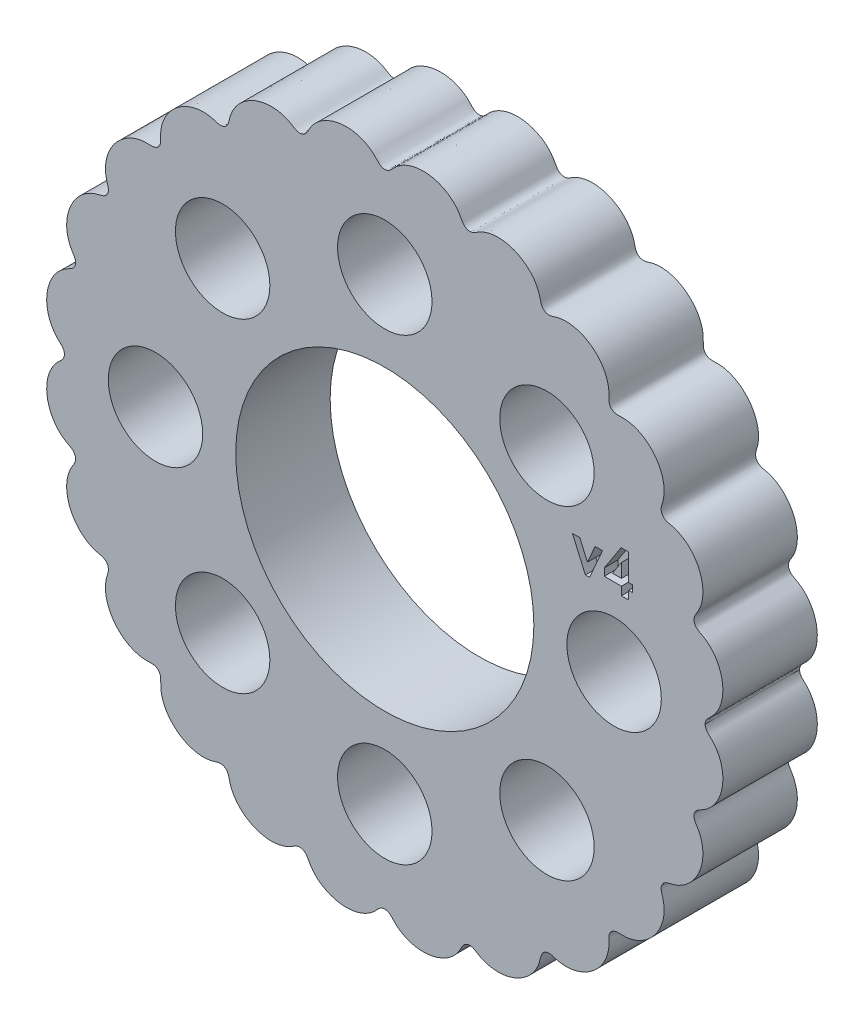
from build123d import *

# Parameters (mm, degrees)
BOSS_EXTRU_1_DEPTH      = 7
ESQUISSE2_R             = 11.05
ESQUISSE2_R_2           = 3.5
ENL_V_MAT_EXTRU_1_DEPTH = 37.128809587
VERSION_TEXT_DEPTH      = 1


with BuildPart() as part:
    # Esquisse1 → Boss.-Extru.1 (new body)
    with BuildSketch(Plane.XY):
        with BuildLine():
            add(Edge.make_bspline(
                [(23.75, 0), (23.75, 0.113685375), (23.821909441, 0.345296585), (24.077868999, 0.583486704), (24.326908063, 0.82199278), (24.613097625, 1.185219288), (24.880013662, 1.699987997), (25.052292539, 2.373710951), (25.0798311, 3.067999967), (24.965816076, 3.753404688), (24.714033606, 4.401107865), (24.329922533, 4.981029619), (23.904223084, 5.375759303), (23.512246653, 5.619286985), (23.197297598, 5.76581327), (22.949715111, 6.022019089), (22.891038655, 6.38200779), (23.037433824, 6.702690369), (23.295515997, 7.083595687), (23.510555882, 7.624702658), (23.606489205, 8.313253156), (23.548852645, 9.00614279), (23.349760744, 9.671786468), (23.019851169, 10.283261952), (22.570667818, 10.813939027), (22.015937939, 11.233039214), (21.481304458, 11.463444711), (21.02942286, 11.550469401), (20.699150262, 11.673684927), (20.485955339, 11.970139566), (20.480065245, 12.325488322), (20.599029023, 12.652377832), (20.704089485, 13.10163791), (20.725962851, 13.681755934), (20.587516766, 14.363396482), (20.30755438, 14.999434924), (19.90351938, 15.56471593), (19.393108738, 16.036186352), (18.794892507, 16.390752797), (18.242165415, 16.566024182), (17.782945063, 16.620462388), (17.438284021, 16.613003815), (17.08841093, 16.600844043), (16.768369356, 16.768381044), (16.600837741, 17.088408326), (16.612865409, 17.438338919), (16.620508986, 17.78290962), (16.56600564, 18.242170576), (16.390761594, 18.794880809), (16.036186226, 19.393104065), (15.564726484, 19.903512039), (14.999452311, 20.30754937), (14.363421334, 20.587508411), (13.681744414, 20.72597752), (13.101626575, 20.704051813), (12.652240196, 20.599124101), (12.325915202, 20.480042723), (11.969680287, 20.486111985), (11.673672202, 20.699151913), (11.550401968, 21.029454781), (11.463686327, 21.481264594), (11.232968039, 22.015956867), (10.813963648, 22.570667237), (10.28323891, 23.019862327), (9.671780311, 23.349763272), (9.006136858, 23.548852351), (8.31323409, 23.606494364), (7.624702202, 23.510546573), (7.083523794, 23.295550947), (6.702658517, 23.037463286), (6.381949654, 22.891053812), (6.022024229, 22.949711541), (5.765785858, 23.197325468), (5.619306078, 23.512255324), (5.375786964, 23.904233943), (4.981023481, 24.329927427), (4.401093787, 24.714039062), (3.753396021, 24.965818304), (3.067994224, 25.079831298), (2.3736948, 25.052292866), (1.699977237, 24.880007741), (1.185224014, 24.613094002), (0.821997983, 24.326886887), (0.583375818, 24.077965546), (0.344602021, 23.821926309), (7.8558e-05, 23.714039229), (-0.344221796, 23.821787286), (-0.58447714, 24.078157256), (-0.821521894, 24.326747519), (-1.185560138, 24.613219127), (-1.699910659, 24.879986409), (-2.373745176, 25.052307156), (-3.06798429, 25.07983), (-3.753392181, 24.965818486), (-4.401098458, 24.714037665), (-4.981023172, 24.329927519), (-5.375788019, 23.904233593), (-5.619305707, 23.512255448), (-5.765785861, 23.197325468), (-6.022024213, 22.949711546), (-6.38194967, 22.891053807), (-6.702658527, 23.037463282), (-7.083523782, 23.295550951), (-7.624702205, 23.510546572), (-8.313234089, 23.606494365), (-9.006136858, 23.548852351), (-9.671780311, 23.349763272), (-10.28323891, 23.019862327), (-10.813963649, 22.570667237), (-11.232968038, 22.015956867), (-11.46368633, 21.481264593), (-11.550401966, 21.029454783), (-11.673672202, 20.699151913), (-11.969680283, 20.486111987), (-12.325915234, 20.480042703), (-12.65224014, 20.599124136), (-13.101626648, 20.70405177), (-13.681744459, 20.725977476), (-14.363421661, 20.587508264), (-14.999451896, 20.307548985), (-15.564726062, 19.903513299), (-16.03618601, 19.393103949), (-16.390762107, 18.79488056), (-16.566006039, 18.24217032), (-16.62050871, 17.782909792), (-16.612865574, 17.438338818), (-16.600837716, 17.088408341), (-16.768369361, 16.76838104), (-17.088410924, 16.600844044), (-17.438284017, 16.613003827), (-17.782945049, 16.620462441), (-18.242165451, 16.566024058), (-18.794892548, 16.39075266), (-19.393108795, 16.036186162), (-19.903519262, 15.564716326), (-20.307553792, 14.999436905), (-20.587516357, 14.363397861), (-20.725962382, 13.681757514), (-20.704095637, 13.101617203), (-20.599029432, 12.652376455), (-20.480043529, 12.325561431), (-20.486003867, 11.969976192), (-20.699111524, 11.673815372), (-21.029403733, 11.55053356), (-21.481261025, 11.46359126), (-22.015948022, 11.23300426), (-22.570659914, 10.813964109), (-23.019856146, 10.283250413), (-23.349759706, 9.671788406), (-23.548851256, 9.006145556), (-23.606489445, 8.313252678), (-23.510556061, 7.62470231), (-23.295515836, 7.083596002), (-23.037433869, 6.70269028), (-22.891038653, 6.382007793), (-22.949715114, 6.022019081), (-23.197297594, 5.765813277), (-23.512246656, 5.619286981), (-23.904223081, 5.375759307), (-24.329922532, 4.98102962), (-24.714033581, 4.401107899), (-24.965816061, 3.753404709), (-25.079831012, 3.068000089), (-25.05229309, 2.373710178), (-24.880012916, 1.69998904), (-24.6131017, 1.185213578), (-24.326904048, 0.821998399), (-24.077859924, 0.583499483), (-23.821910499, 0.345294915), (-23.75, 0.113685685), (-23.75, 0)],
                knots=[0.075303121, 0.075303121, 0.075303121, 0.075303121, 0.078621066, 0.081939011, 0.085256955, 0.0885749, 0.095210789, 0.101846679, 0.108482568, 0.115118457, 0.121754346, 0.128390236, 0.135026125, 0.13834407, 0.141662014, 0.144979959, 0.148297904, 0.151615848, 0.154933793, 0.161569682, 0.168205571, 0.174841461, 0.18147735, 0.188113239, 0.194749129, 0.201385018, 0.208020907, 0.211338852, 0.214656796, 0.217974741, 0.221292686, 0.22461063, 0.227928575, 0.234564464, 0.241200354, 0.247836243, 0.254472132, 0.261108021, 0.267743911, 0.2743798, 0.277697745, 0.281015689, 0.284333634, 0.287651579, 0.290969523, 0.294287468, 0.297605412, 0.300923357, 0.307559246, 0.314195136, 0.320831025, 0.327466914, 0.334102804, 0.340738693, 0.347374582, 0.350692527, 0.354010471, 0.357328416, 0.360646361, 0.363964305, 0.36728225, 0.373918139, 0.380554029, 0.387189918, 0.393825807, 0.400461696, 0.407097586, 0.413733475, 0.420369364, 0.423687309, 0.427005254, 0.430323198, 0.433641143, 0.436959087, 0.440277032, 0.446912921, 0.453548811, 0.4601847, 0.466820589, 0.473456478, 0.480092368, 0.486728257, 0.490046202, 0.493364146, 0.496682091, 0.500000036, 0.50331798, 0.506635925, 0.50995387, 0.513271814, 0.519907703, 0.526543593, 0.533179482, 0.539815371, 0.546451261, 0.55308715, 0.559723039, 0.563040984, 0.566358928, 0.569676873, 0.572994818, 0.576312762, 0.579630707, 0.586266596, 0.592902486, 0.599538375, 0.606174264, 0.612810153, 0.619446043, 0.626081932, 0.632717821, 0.636035766, 0.639353711, 0.642671655, 0.6459896, 0.649307545, 0.652625489, 0.659261378, 0.665897268, 0.672533157, 0.679169046, 0.685804936, 0.692440825, 0.699076714, 0.702394659, 0.705712603, 0.709030548, 0.712348493, 0.715666437, 0.718984382, 0.722302327, 0.725620271, 0.732256161, 0.73889205, 0.745527939, 0.752163828, 0.758799718, 0.765435607, 0.772071496, 0.775389441, 0.778707386, 0.78202533, 0.785343275, 0.78866122, 0.791979164, 0.798615053, 0.805250943, 0.811886832, 0.818522721, 0.825158611, 0.8317945, 0.838430389, 0.845066278, 0.848384223, 0.851702168, 0.855020112, 0.858338057, 0.861656002, 0.864973946, 0.871609836, 0.878245725, 0.884881614, 0.891517503, 0.898153393, 0.904789282, 0.911425171, 0.914743116, 0.918061061, 0.921379005, 0.92469695, 0.92469695, 0.92469695, 0.92469695], degree=3))
            add(Edge.make_bspline(
                [(-23.75, 0), (-23.75, -0.113685685), (-23.821910499, -0.345294915), (-24.077859924, -0.583499483), (-24.326904048, -0.821998399), (-24.6131017, -1.185213578), (-24.880012916, -1.69998904), (-25.05229309, -2.373710178), (-25.079831012, -3.068000089), (-24.965816061, -3.753404709), (-24.714033581, -4.401107899), (-24.329922532, -4.98102962), (-23.904223081, -5.375759307), (-23.512246656, -5.619286981), (-23.197297594, -5.765813277), (-22.949715114, -6.022019081), (-22.891038653, -6.382007793), (-23.037433869, -6.70269028), (-23.295515836, -7.083596002), (-23.510556061, -7.62470231), (-23.606489445, -8.313252678), (-23.548851256, -9.006145556), (-23.349759706, -9.671788406), (-23.019856146, -10.283250413), (-22.570659914, -10.813964109), (-22.015948022, -11.23300426), (-21.481261025, -11.46359126), (-21.029403733, -11.55053356), (-20.699111524, -11.673815372), (-20.486003867, -11.969976192), (-20.480043529, -12.325561431), (-20.599029432, -12.652376455), (-20.704095637, -13.101617203), (-20.725962382, -13.681757514), (-20.587516357, -14.363397861), (-20.307553792, -14.999436905), (-19.903519262, -15.564716326), (-19.393108795, -16.036186162), (-18.794892548, -16.39075266), (-18.242165451, -16.566024058), (-17.782945049, -16.620462441), (-17.438284017, -16.613003827), (-17.088410924, -16.600844044), (-16.768369361, -16.76838104), (-16.600837716, -17.088408341), (-16.612865574, -17.438338818), (-16.62050871, -17.782909792), (-16.566006039, -18.24217032), (-16.390762107, -18.79488056), (-16.03618601, -19.393103949), (-15.564726062, -19.903513299), (-14.999451896, -20.307548985), (-14.363421661, -20.587508264), (-13.681744459, -20.725977476), (-13.101626648, -20.70405177), (-12.65224014, -20.599124136), (-12.325915234, -20.480042703), (-11.969680283, -20.486111987), (-11.673672202, -20.699151913), (-11.550401966, -21.029454783), (-11.46368633, -21.481264593), (-11.232968038, -22.015956867), (-10.813963649, -22.570667237), (-10.28323891, -23.019862327), (-9.671780311, -23.349763272), (-9.006136858, -23.548852351), (-8.313234089, -23.606494365), (-7.624702205, -23.510546572), (-7.083523782, -23.295550951), (-6.702658527, -23.037463282), (-6.38194967, -22.891053807), (-6.022024213, -22.949711546), (-5.765785861, -23.197325468), (-5.619305707, -23.512255448), (-5.375788019, -23.904233593), (-4.981023172, -24.329927519), (-4.401098458, -24.714037665), (-3.753392181, -24.965818486), (-3.06798429, -25.07983), (-2.373745176, -25.052307156), (-1.699910659, -24.879986409), (-1.185560138, -24.613219127), (-0.821521894, -24.326747519), (-0.58447714, -24.078157256), (-0.344221796, -23.821787286), (7.8558e-05, -23.714039229), (0.344602021, -23.821926309), (0.583375818, -24.077965546), (0.821997983, -24.326886887), (1.185224014, -24.613094002), (1.699977237, -24.880007741), (2.3736948, -25.052292866), (3.067994224, -25.079831298), (3.753396021, -24.965818304), (4.401093787, -24.714039062), (4.981023481, -24.329927427), (5.375786964, -23.904233943), (5.619306078, -23.512255324), (5.765785858, -23.197325468), (6.022024229, -22.949711541), (6.381949654, -22.891053812), (6.702658517, -23.037463286), (7.083523794, -23.295550947), (7.624702202, -23.510546573), (8.31323409, -23.606494364), (9.006136858, -23.548852351), (9.671780311, -23.349763272), (10.28323891, -23.019862327), (10.813963648, -22.570667237), (11.232968039, -22.015956867), (11.463686327, -21.481264594), (11.550401968, -21.029454781), (11.673672202, -20.699151913), (11.969680287, -20.486111985), (12.325915202, -20.480042723), (12.652240196, -20.599124101), (13.101626575, -20.704051813), (13.681744414, -20.72597752), (14.363421334, -20.587508411), (14.999452311, -20.30754937), (15.564726484, -19.903512039), (16.036186226, -19.393104065), (16.390761594, -18.794880809), (16.56600564, -18.242170576), (16.620508986, -17.78290962), (16.612865409, -17.438338919), (16.600837741, -17.088408326), (16.768369356, -16.768381044), (17.08841093, -16.600844043), (17.438284021, -16.613003815), (17.782945063, -16.620462388), (18.242165415, -16.566024182), (18.794892507, -16.390752797), (19.393108738, -16.036186352), (19.90351938, -15.56471593), (20.30755438, -14.999434924), (20.587516766, -14.363396482), (20.725962851, -13.681755934), (20.704089485, -13.10163791), (20.599029023, -12.652377832), (20.480065245, -12.325488322), (20.485955339, -11.970139566), (20.699150262, -11.673684927), (21.02942286, -11.550469401), (21.481304458, -11.463444711), (22.015937939, -11.233039214), (22.570667818, -10.813939027), (23.019851169, -10.283261952), (23.349760744, -9.671786468), (23.548852645, -9.00614279), (23.606489205, -8.313253156), (23.510555882, -7.624702658), (23.295515997, -7.083595686), (23.037433824, -6.702690369), (22.891038655, -6.38200779), (22.949715111, -6.022019089), (23.197297598, -5.76581327), (23.512246653, -5.619286985), (23.904223084, -5.375759303), (24.329922533, -4.981029619), (24.714033606, -4.401107865), (24.965816076, -3.753404688), (25.0798311, -3.067999967), (25.052292539, -2.373710951), (24.880013662, -1.699987997), (24.613097625, -1.185219288), (24.326908063, -0.82199278), (24.077868999, -0.583486704), (23.821909441, -0.345296585), (23.75, -0.113685375), (23.75, 0)],
                knots=[0.075303121, 0.075303121, 0.075303121, 0.075303121, 0.078621066, 0.081939011, 0.085256955, 0.0885749, 0.095210789, 0.101846679, 0.108482568, 0.115118457, 0.121754346, 0.128390236, 0.135026125, 0.13834407, 0.141662014, 0.144979959, 0.148297904, 0.151615848, 0.154933793, 0.161569682, 0.168205571, 0.174841461, 0.18147735, 0.188113239, 0.194749129, 0.201385018, 0.208020907, 0.211338852, 0.214656796, 0.217974741, 0.221292686, 0.22461063, 0.227928575, 0.234564464, 0.241200354, 0.247836243, 0.254472132, 0.261108021, 0.267743911, 0.2743798, 0.277697745, 0.281015689, 0.284333634, 0.287651579, 0.290969523, 0.294287468, 0.297605412, 0.300923357, 0.307559246, 0.314195136, 0.320831025, 0.327466914, 0.334102804, 0.340738693, 0.347374582, 0.350692527, 0.354010471, 0.357328416, 0.360646361, 0.363964305, 0.36728225, 0.373918139, 0.380554029, 0.387189918, 0.393825807, 0.400461696, 0.407097586, 0.413733475, 0.420369364, 0.423687309, 0.427005254, 0.430323198, 0.433641143, 0.436959087, 0.440277032, 0.446912921, 0.453548811, 0.4601847, 0.466820589, 0.473456478, 0.480092368, 0.486728257, 0.490046202, 0.493364146, 0.496682091, 0.500000036, 0.50331798, 0.506635925, 0.50995387, 0.513271814, 0.519907703, 0.526543593, 0.533179482, 0.539815371, 0.546451261, 0.55308715, 0.559723039, 0.563040984, 0.566358928, 0.569676873, 0.572994818, 0.576312762, 0.579630707, 0.586266596, 0.592902486, 0.599538375, 0.606174264, 0.612810153, 0.619446043, 0.626081932, 0.632717821, 0.636035766, 0.639353711, 0.642671655, 0.6459896, 0.649307545, 0.652625489, 0.659261378, 0.665897268, 0.672533157, 0.679169046, 0.685804936, 0.692440825, 0.699076714, 0.702394659, 0.705712603, 0.709030548, 0.712348493, 0.715666437, 0.718984382, 0.722302327, 0.725620271, 0.732256161, 0.73889205, 0.745527939, 0.752163828, 0.758799718, 0.765435607, 0.772071496, 0.775389441, 0.778707386, 0.78202533, 0.785343275, 0.78866122, 0.791979164, 0.798615053, 0.805250943, 0.811886832, 0.818522721, 0.825158611, 0.8317945, 0.838430389, 0.845066278, 0.848384223, 0.851702168, 0.855020112, 0.858338057, 0.861656002, 0.864973946, 0.871609836, 0.878245725, 0.884881614, 0.891517503, 0.898153393, 0.904789282, 0.911425171, 0.914743116, 0.918061061, 0.921379005, 0.92469695, 0.92469695, 0.92469695, 0.92469695], degree=3))
        make_face()
    extrude(amount=BOSS_EXTRU_1_DEPTH)

    # Esquisse2 → Enlèv. mat.-Extru.1 (cut, through all)
    with BuildSketch(Plane.XY.offset(7)):
        Circle(ESQUISSE2_R)
        with Locations((0, 17)):
            Circle(ESQUISSE2_R_2)
        with Locations((12.02081528, 12.02081528)):
            Circle(ESQUISSE2_R_2)
        with Locations((17, 0)):
            Circle(ESQUISSE2_R_2)
        with Locations((12.02081528, -12.02081528)):
            Circle(ESQUISSE2_R_2)
        with Locations((0, -17)):
            Circle(ESQUISSE2_R_2)
        with Locations((-12.02081528, -12.02081528)):
            Circle(ESQUISSE2_R_2)
        with Locations((-17, 0)):
            Circle(ESQUISSE2_R_2)
        with Locations((-12.02081528, 12.02081528)):
            Circle(ESQUISSE2_R_2)
    extrude(amount=-ENL_V_MAT_EXTRU_1_DEPTH, mode=Mode.SUBTRACT)

    # Esquisse3 → Version Text (cut)
    # profile 1 of 2: a face of its own
    with BuildSketch(Plane.XY.offset(7)):
        Polygon((13.908835076, 7.33539229), (14.456911999, 7.33539229), (15.024219692, 6.041522098), (15.591527384, 7.33539229), (16.139604307, 7.33539229), (15.179267769, 5.143084598), (14.869171615, 5.143084598), align=None)
    # profile 2 of 2: a face of its own
    with BuildSketch(Plane.XY.offset(7)):
        Polygon((17.520613922, 8.220007674), (18.081911999, 8.220007674), (18.081911999, 6.258469213), (18.351142769, 6.258469213), (18.351142769, 5.758469213), (18.081911999, 5.758469213), (18.081911999, 5.143084598), (17.543450461, 5.143084598), (17.543450461, 5.758469213), (16.274219692, 5.758469213), (16.274219692, 6.303541328), align=None)
        Polygon((17.543450461, 6.258469213), (17.543450461, 7.279502867), (16.879387961, 6.258469213), align=None, mode=Mode.SUBTRACT)
    extrude(amount=-VERSION_TEXT_DEPTH, mode=Mode.SUBTRACT)


solid = part.part
